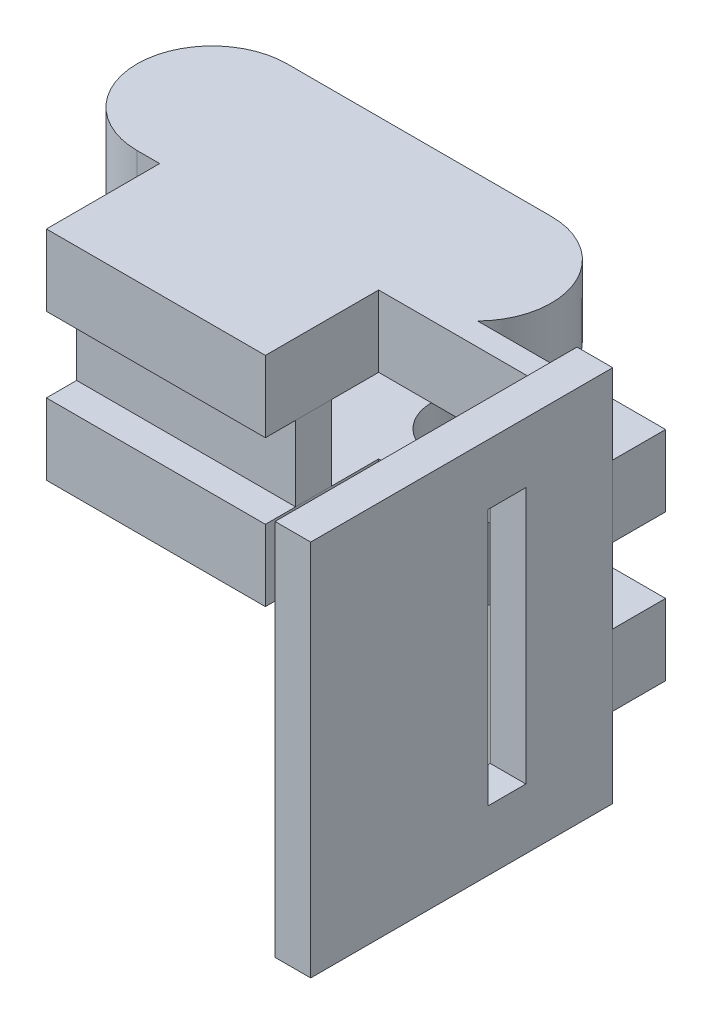
from build123d import *

# Parameters (mm, degrees)
BOSS_EXTRUDE1_DEPTH = 12
SKETCH1_3_R         = 7.540625
SKETCH1_3_W         = 26.67
SKETCH1_3_H         = 6
CUT_EXTRUDE1_DEPTH  = 6
BOSS_EXTRUDE3_DEPTH = 12
BOSS_EXTRUDE2_DEPTH = 6
SKETCH4_W           = 50.8
SKETCH4_H           = 63.5
SKETCH4_W_2         = 6.35
SKETCH4_H_2         = 43.18
BOSS_EXTRUDE4_DEPTH = 6


with BuildPart() as part:
    # Sketch1 → Boss-Extrude1 (new body)
    with BuildSketch(Plane(origin=(0, 0, 0), x_dir=(1, 0, 0), z_dir=(0, 1, 0))):
        with BuildLine():
            Line((0, 12.620625), (44.45, 12.620625))
            ThreePointArc((44.45, 12.620625), (57.070625, 0), (44.45, -12.620625))
            Line((44.45, -12.620625), (40.64, -12.620625))
            Line((40.64, -12.620625), (40.64, -31.670625))
            Line((40.64, -31.670625), (3.81, -31.670625))
            Line((3.81, -31.670625), (3.81, -12.620625))
            Line((3.81, -12.620625), (0, -12.620625))
            ThreePointArc((0, -12.620625), (-12.620625, 0), (0, 12.620625))
        make_face()
    extrude(amount=BOSS_EXTRUDE1_DEPTH)

    # Sketch1<3> → Cut-Extrude1 (cut)
    with BuildSketch(Plane(origin=(0, 0, 0), x_dir=(1, 0, 0), z_dir=(0, 1, 0))):
        with Locations(Location((0, 0, 0), (0, 0, 270))):
            Circle(SKETCH1_3_R)
        with Locations(Location((44.45, 0, 0), (0, 0, 270))):
            Circle(SKETCH1_3_R)
        with Locations((22.225, -23.590625)):
            Rectangle(SKETCH1_3_W, SKETCH1_3_H)
    extrude(amount=CUT_EXTRUDE1_DEPTH, mode=Mode.SUBTRACT)

    # Sketch3 → Boss-Extrude3 (add)
    with BuildSketch(Plane.XZ):
        Polygon((85.09, 12.620625), (85.09, 17.700625), (79.09, 17.700625), (79.09, 12.620625), (40.64, 12.620625), (40.64, 8.810625), (85.09, 8.810625), align=None)
    extrude(amount=-BOSS_EXTRUDE3_DEPTH)


with BuildPart() as body_2:
    # Mirror1: mirrored copy
    add(part.part.mirror(Plane(origin=(0, -6.303125062, 0), x_dir=(0, 0, 1), z_dir=(0, -1, 0))))


with BuildPart() as body_3:
    # Sketch2 → Boss-Extrude2 (new body)
    with BuildSketch(Plane.XY.offset(20.590625)):
        Polygon((8.89, -12.606250124), (8.89, -18.606250124), (35.56, -18.606250124), (35.56, -12.606250124), (40.64, -12.606250124), (40.64, 0), (35.56, 0), (35.56, 6), (8.89, 6), (8.89, 0), (3.81, 0), (3.81, -12.606250124), align=None)
    extrude(amount=BOSS_EXTRUDE2_DEPTH)


with BuildPart() as body_4:
    # Sketch4 → Boss-Extrude4 (new body)
    with BuildSketch(Plane(origin=(85.09, 0, 0), x_dir=(0, 0, -1), z_dir=(1, 0, 0))):
        with Locations((-43.100625, -6.303125062)):
            Rectangle(SKETCH4_W, SKETCH4_H)
        with Locations((-35.480625, -6.303125062)):
            Rectangle(SKETCH4_W_2, SKETCH4_H_2, mode=Mode.SUBTRACT)
    extrude(amount=-BOSS_EXTRUDE4_DEPTH)


solid = Compound([part.part, body_2.part, body_3.part, body_4.part])
